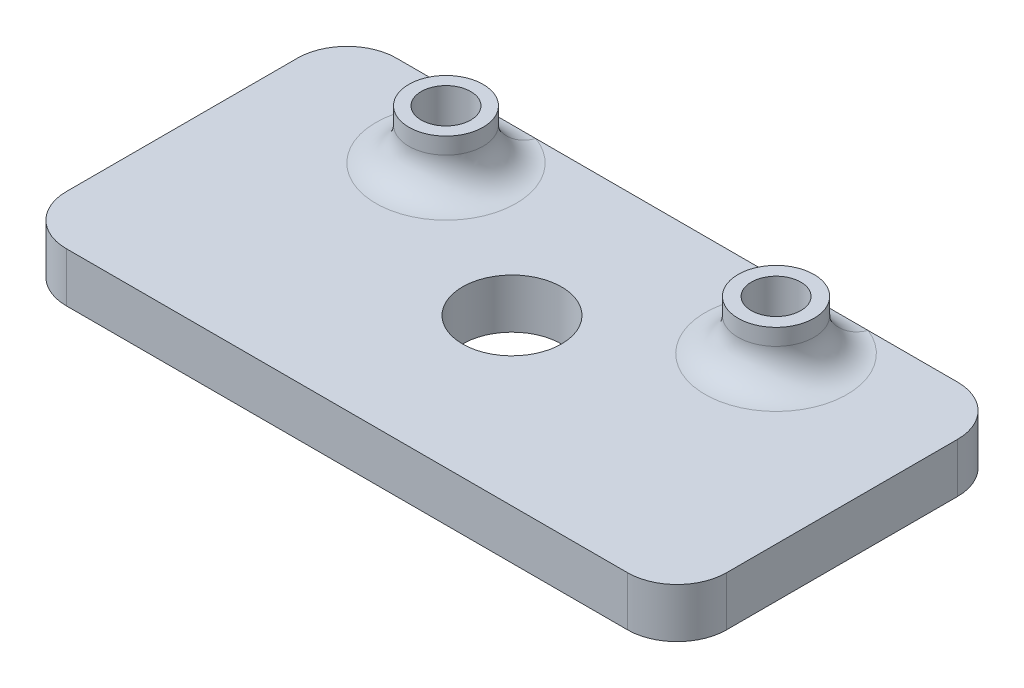
from build123d import *

# Parameters (mm, degrees)
SKETCH1_W           = 40
SKETCH1_H           = 20
SKETCH1_R           = 1.5
BOSS_EXTRUDE1_DEPTH = 3
FILLET1_R           = 3
SKETCH2_R           = 2.25
SKETCH2_R_2         = 1.5
SKETCH2_R_3         = 2.3
BOSS_EXTRUDE2_DEPTH = 3
SKETCH3_R           = 3
CUT_EXTRUDE1_DEPTH  = 10
FILLET2_R           = 2


with BuildPart() as part:
    # Sketch1 → Boss-Extrude1 (new body)
    with BuildSketch(Plane(origin=(0, 0, 0), x_dir=(1, 0, 0), z_dir=(0, 1, 0))):
        Rectangle(SKETCH1_W, SKETCH1_H)
        with Locations(Location((-10, 6, 0), (0, 0, 270))):
            Circle(SKETCH1_R, mode=Mode.SUBTRACT)
        with Locations(Location((10, 6, 0), (0, 0, 90))):
            Circle(SKETCH1_R, mode=Mode.SUBTRACT)
    extrude(amount=BOSS_EXTRUDE1_DEPTH)

    # Fillet1
    fillet1_edges = [part.edges().sort_by_distance(p)[0] for p in [
        (20, 1.5, 10),
        (-20, 1.5, 10),
        (-20, 1.5, -10),
        (20, 1.5, -10),
    ]]
    fillet(fillet1_edges, radius=FILLET1_R)

    # Sketch2 → Boss-Extrude2 (add)
    # profile 1 of 2: a face of its own
    with BuildSketch(Plane(origin=(0, 3, 0), x_dir=(1, 0, 0), z_dir=(0, 1, 0))):
        with Locations(Location((-10, 6, 0), (0, 0, 270))):
            Circle(SKETCH2_R)
        with Locations(Location((-10, 6, 0), (0, 0, 270))):
            Circle(SKETCH2_R_2, mode=Mode.SUBTRACT)
    # profile 2 of 2: a face of its own
    with BuildSketch(Plane(origin=(0, 3, 0), x_dir=(1, 0, 0), z_dir=(0, 1, 0))):
        with Locations(Location((10, 6, 0), (0, 0, 270))):
            Circle(SKETCH2_R_3)
        with Locations(Location((10, 6, 0), (0, 0, 90))):
            Circle(SKETCH2_R_2, mode=Mode.SUBTRACT)
    extrude(amount=BOSS_EXTRUDE2_DEPTH)

    # Sketch3 → Cut-Extrude1 (cut)
    with BuildSketch(Plane(origin=(0, 3, 0), x_dir=(1, 0, 0), z_dir=(0, 1, 0))):
        with Locations(Location((0, 0, 0), (0, 0, 270))):
            Circle(SKETCH3_R)
    extrude(amount=-CUT_EXTRUDE1_DEPTH, mode=Mode.SUBTRACT)

    # Fillet2
    fillet2_edges = [part.edges().sort_by_distance(p)[0] for p in [
        (-10, 3, -8.25),
        (10, 3, -8.3),
    ]]
    fillet(fillet2_edges, radius=FILLET2_R)


solid = part.part
